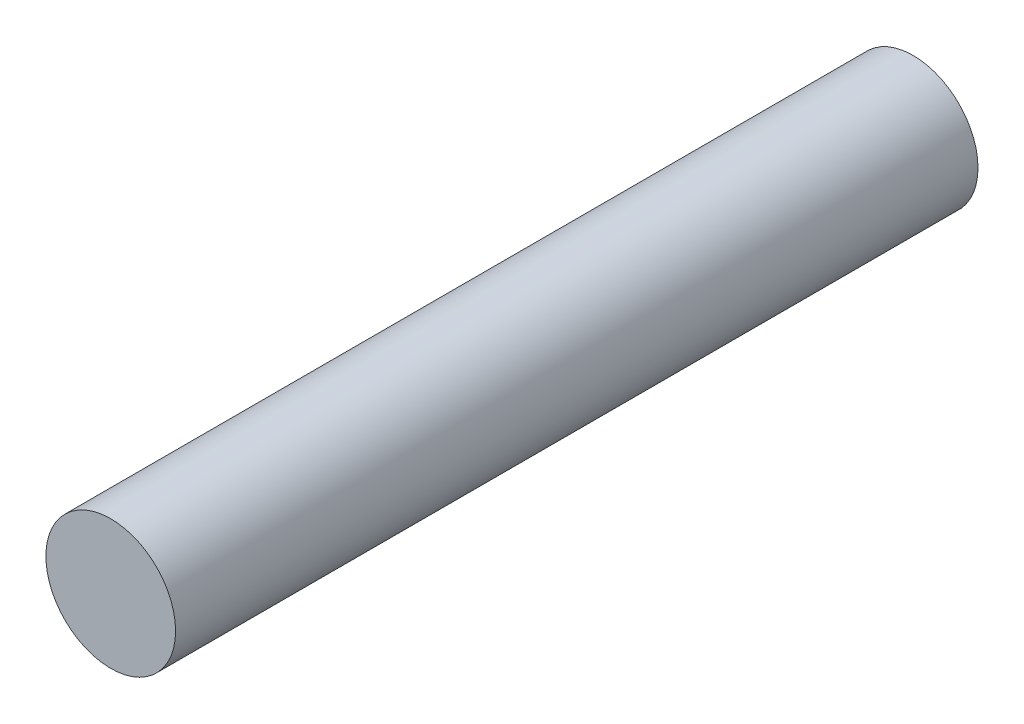
from build123d import *

# Parameters (mm, degrees)
SKETCH1_R           = 26.67
BOSS_EXTRUDE1_DEPTH = 330


with BuildPart() as part:
    # Sketch1 → Boss-Extrude1 (new body)
    with BuildSketch(Plane.XY):
        Circle(SKETCH1_R)
    extrude(amount=BOSS_EXTRUDE1_DEPTH)


solid = part.part
